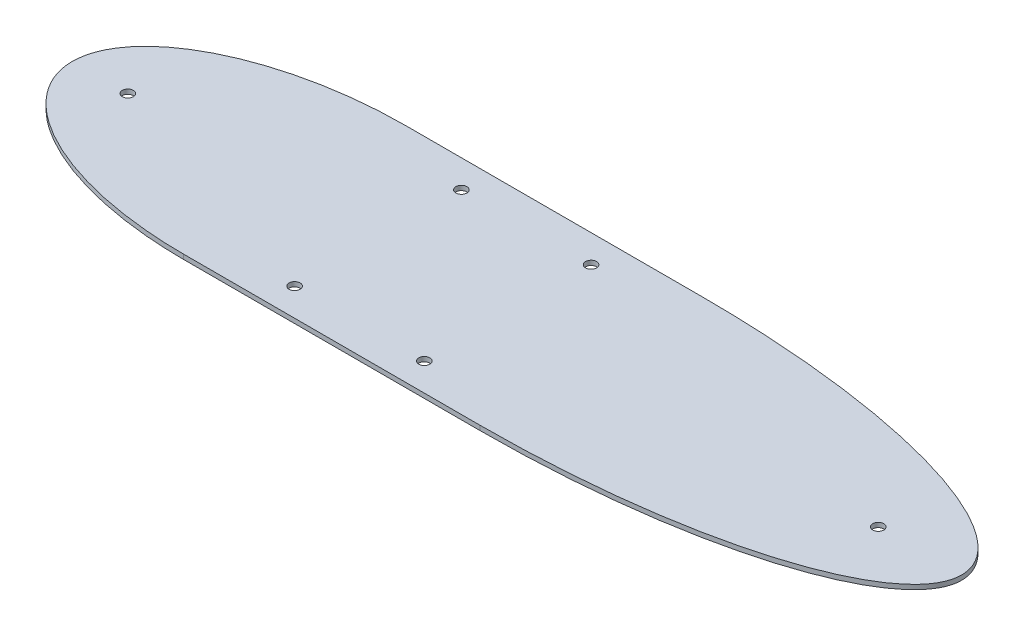
from build123d import *

# Parameters (mm, degrees)
BOSS_EXTRUDE1_DEPTH       = 1.5875
F_6_CLEARANCE_HOLE1_D     = 3.7973
F_6_CLEARANCE_HOLE2_D     = 3.7973
F_6_CLEARANCE_HOLE2_DEPTH = 25.4
F_6_CLEARANCE_HOLE2_TIP   = 1.140824014
F_6_CLEARANCE_HOLE3_D     = 3.7973
F_6_CLEARANCE_HOLE3_DEPTH = 25.4
F_6_CLEARANCE_HOLE3_TIP   = 1.140824014


with BuildPart() as part:
    # Sketch11 → Boss-Extrude1 (new body)
    with BuildSketch(Plane(origin=(0, 0, 0), x_dir=(1, 0, 0), z_dir=(0, 1, 0))):
        with BuildLine():
            Line((177.8, 38.1), (76.2, 38.1))
            add(Edge.make_bspline(
                [(76.2, 38.1), (-76.2, 38.1), (-76.2, -38.1), (76.2, -38.1)],
                knots=[0, 0, 0, 0, 1, 1, 1, 1], degree=3, weights=[1, 0.333333333, 0.333333333, 1]))
            Line((76.2, -38.1), (177.8, -38.1))
            add(Edge.make_bspline(
                [(177.8, -38.1), (431.8, -38.1), (431.8, 38.1), (177.8, 38.1)],
                knots=[0, 0, 0, 0, 1, 1, 1, 1], degree=3, weights=[1, 0.333333333, 0.333333333, 1]))
        make_face()
    extrude(amount=BOSS_EXTRUDE1_DEPTH)

    # #6 Clearance Hole1 (through all)
    with Locations(Plane(origin=(0, 0, 0), x_dir=(-1, 0, 0), z_dir=(0, -1, 0))):
        with Locations((-104.775, -28.575), (-149.225, -28.575), (-149.225, 28.575), (-104.775, 28.575)):
            Hole(F_6_CLEARANCE_HOLE1_D / 2)

    # #6 Clearance Hole2
    with Locations(Plane(origin=(0, 0, 0), x_dir=(-1, 0, 0), z_dir=(0, -1, 0))):
        with Locations((-19.05, 0)):
            Hole(F_6_CLEARANCE_HOLE2_D / 2, depth=F_6_CLEARANCE_HOLE2_DEPTH)
            with Locations((0, 0, -(F_6_CLEARANCE_HOLE2_DEPTH + F_6_CLEARANCE_HOLE2_TIP / 2))):  # 118° drill point
                Cone(0, F_6_CLEARANCE_HOLE2_D / 2, F_6_CLEARANCE_HOLE2_TIP, mode=Mode.SUBTRACT)

    # #6 Clearance Hole3
    with Locations(Plane(origin=(0, 0, 0), x_dir=(-1, 0, 0), z_dir=(0, -1, 0))):
        with Locations((-276.225, 0)):
            Hole(F_6_CLEARANCE_HOLE3_D / 2, depth=F_6_CLEARANCE_HOLE3_DEPTH)
            with Locations((0, 0, -(F_6_CLEARANCE_HOLE3_DEPTH + F_6_CLEARANCE_HOLE3_TIP / 2))):  # 118° drill point
                Cone(0, F_6_CLEARANCE_HOLE3_D / 2, F_6_CLEARANCE_HOLE3_TIP, mode=Mode.SUBTRACT)


solid = part.part
